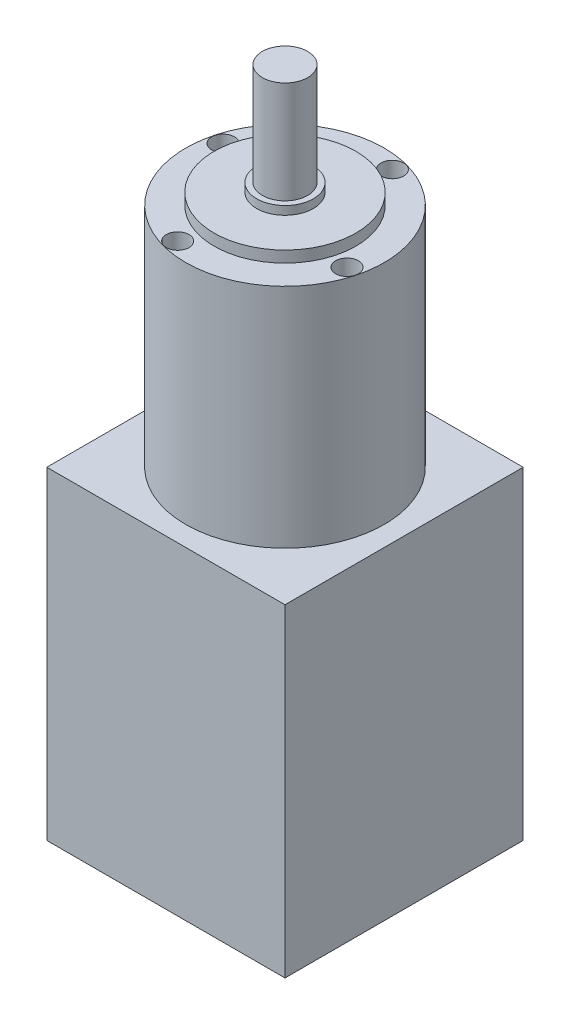
from build123d import *

# Parameters (mm, degrees)
SKETCH_1_W          = 42
SKETCH_1_H          = 42
EXTRUDE_1_DEPTH     = 57
EXTRUDE_START       = 57
SKETCH_2_R          = 17.5
EXTRUDE_2_DEPTH     = 40
EXTRUDE_START_2     = 97
SKETCH_3_R          = 12.5
EXTRUDE_3_DEPTH     = 2
EXTRUDE_START_3     = 99
SKETCH_4_R          = 5
EXTRUDE_4_DEPTH     = 1.5
EXTRUDE_START_4     = 100.5
SKETCH_5_R          = 4
EXTRUDE_5_DEPTH     = 18
CUT_EXTRUDE_START   = 97
SKETCH_6_R          = 2
CUT_EXTRUDE_2_DEPTH = 15


with BuildPart() as part:
    # 草图1 → 凸台-拉伸1 (new body)
    with BuildSketch(Plane(origin=(0, 0, 0), x_dir=(1, 0, 0), z_dir=(0, 1, 0))):
        Rectangle(SKETCH_1_W, SKETCH_1_H)
    extrude(amount=EXTRUDE_1_DEPTH)

    # 草图2 → 凸台-拉伸2 (add)
    with BuildSketch(Plane(origin=(0, 0, 0), x_dir=(1, 0, 0), z_dir=(0, 1, 0)).offset(EXTRUDE_START)):
        with Locations(Location((0, 0, 0), (0, 0, 90))):
            Circle(SKETCH_2_R)
    extrude(amount=EXTRUDE_2_DEPTH)

    # 草图3 → 凸台-拉伸3 (add)
    with BuildSketch(Plane(origin=(0, 0, 0), x_dir=(1, 0, 0), z_dir=(0, 1, 0)).offset(EXTRUDE_START_2)):
        with Locations(Location((0, 0, 0), (0, 0, 90))):
            Circle(SKETCH_3_R)
    extrude(amount=EXTRUDE_3_DEPTH)

    # 草图4 → 凸台-拉伸4 (add)
    with BuildSketch(Plane(origin=(0, 0, 0), x_dir=(1, 0, 0), z_dir=(0, 1, 0)).offset(EXTRUDE_START_3)):
        with Locations(Location((0, 0, 0), (0, 0, 90))):
            Circle(SKETCH_4_R)
    extrude(amount=EXTRUDE_4_DEPTH)

    # 草图5 → 凸台-拉伸5 (add)
    with BuildSketch(Plane(origin=(0, 0, 0), x_dir=(1, 0, 0), z_dir=(0, 1, 0)).offset(EXTRUDE_START_4)):
        with Locations(Location((0, 0, 0), (0, 0, 90))):
            Circle(SKETCH_5_R)
    extrude(amount=EXTRUDE_5_DEPTH)

    # 草图6 → 切除-拉伸2 (cut)
    with BuildSketch(Plane(origin=(0, 0, 0), x_dir=(1, 0, 0), z_dir=(0, 1, 0)).offset(CUT_EXTRUDE_START)):
        with Locations(Location((3.998754247, 14.923554016, 0), (0, 0, 90))):
            Circle(SKETCH_6_R)
        with Locations(Location((14.923554016, -3.998754247, 0), (0, 0, 90))):
            Circle(SKETCH_6_R)
        with Locations(Location((-3.998754247, -14.923554016, 0), (0, 0, 90))):
            Circle(SKETCH_6_R)
        with Locations(Location((-14.923554016, 3.998754247, 0), (0, 0, 90))):
            Circle(SKETCH_6_R)
    extrude(amount=-CUT_EXTRUDE_2_DEPTH, mode=Mode.SUBTRACT)


solid = part.part
